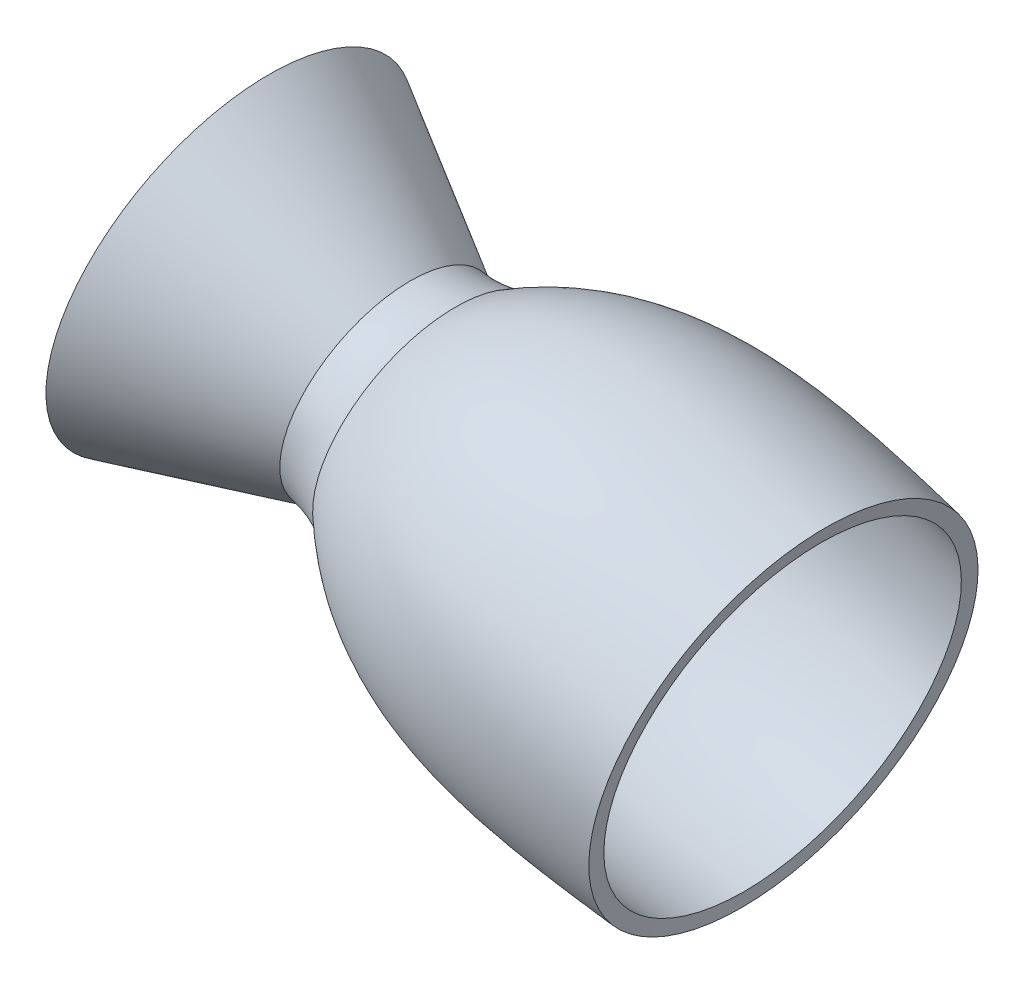
from build123d import *


with BuildPart() as part:
    # Sketch2 → Revolve2 (revolve)
    with BuildSketch(Plane.XY, mode=Mode.PRIVATE) as revolve2_sk:
        with BuildLine():
            Line((-43.716221153, 70.946214002), (-180.219914565, 175.370357373))
            Line((-180.219914565, 175.370357373), (-180.219914565, 162.632951378))
            Line((-180.219914565, 162.632951378), (-43.716221153, 58.871410928))
            ThreePointArc((-43.716221153, 58.871410928), (-18.430081053, 50.394075819), (7.194859268, 57.78437522))
            add(Edge.make_bspline(
                [(7.194859268, 57.78437522), (8.928872852, 58.732265854), (12.430594707, 60.597595675), (19.407375105, 64.12178198), (28.153172213, 68.187413259), (38.666050393, 72.531541725), (52.717788584, 77.643180346), (70.34822503, 82.805552541), (91.624876371, 87.192047227), (113.029883128, 89.915434257), (141.74154758, 91.515793324), (177.937561467, 90.050923585), (221.72262923, 83.855479767), (265.65937236, 74.370818314), (302.216165626, 64.722148717), (331.352600516, 56.561988678), (345.834640133, 52.448432595), (353.087325703, 50.398999409)],
                knots=[0, 0, 0, 0, 0.015625, 0.03125, 0.0625, 0.09375, 0.125, 0.1875, 0.25, 0.3125, 0.375, 0.5, 0.625, 0.75, 0.875, 0.9375, 1, 1, 1, 1], degree=3))
            Line((353.087325703, 50.398999409), (357.166240613, 64.833764844))
            add(Edge.make_bspline(
                [(0, 70.946214002), (117.631064711, 135.248700165), (241.601433893, 97.489578707), (357.166240613, 64.833764844)],
                knots=[0, 0, 0, 0, 1, 1, 1, 1], degree=3))
            ThreePointArc((0, 70.946214002), (-21.858110577, 68.683063299), (-43.716221153, 70.946214002))
        make_face()
    revolve(revolve2_sk.sketch.rotate(Axis((-43.716221153, -32.954054974, 0), (0.9754826443933732, -0.22007637421429832, 0)), 180), axis=Axis((-43.716221153, -32.954054974, 0), (0.9754826443933732, -0.22007637421429832, 0)))


solid = part.part
